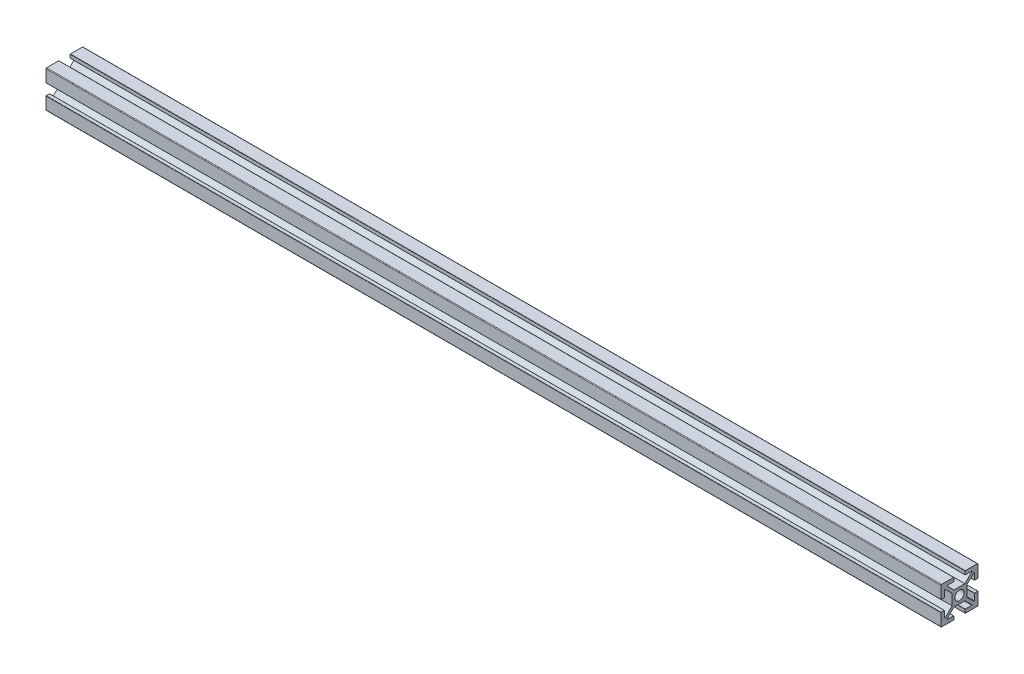
from build123d import *

# Parameters (mm, degrees)
SKETCH1_R           = 2.5
BOSS_EXTRUDE1_DEPTH = 485
SKETCH2_R           = 2.5
CUT_EXTRUDE1_DEPTH  = 2


with BuildPart() as part:
    # Sketch1 → Boss-Extrude1 (new body)
    with BuildSketch(Plane(origin=(0, 0, 0), x_dir=(0, 0, -1), z_dir=(1, 0, 0))):
        with BuildLine():
            Line((-7.427382464, 2.155691805), (-5.727382464, 2.155691805))
            ThreePointArc((-5.727382464, 2.155691805), (-5.621316447, 2.199625788), (-5.577382464, 2.305691805))
            Line((-5.577382464, 2.305691805), (-5.577382464, 5.741876319))
            ThreePointArc((-5.577382464, 5.741876319), (-5.485183419, 5.880292537), (-5.321928469, 5.848550846))
            Line((-5.321928469, 5.848550846), (-1.531086168, 2.101082027))
            Line((-1.531086168, 2.101082027), (-1.531086168, -3.789698417))
            Line((-1.531086168, -3.789698417), (-5.321928469, -7.537167236))
            ThreePointArc((-5.321928469, -7.537167236), (-5.485183419, -7.568908927), (-5.577382464, -7.430492708))
            Line((-5.577382464, -7.430492708), (-5.577382464, -3.994308195))
            ThreePointArc((-5.577382464, -3.994308195), (-5.621316447, -3.888242178), (-5.727382464, -3.844308195))
            Line((-5.727382464, -3.844308195), (-7.427382464, -3.844308195))
            ThreePointArc((-7.427382464, -3.844308195), (-7.533448481, -3.888242178), (-7.577382464, -3.994308195))
            Line((-7.577382464, -3.994308195), (-7.577382464, -10.494308195))
            ThreePointArc((-7.577382464, -10.494308195), (-7.474869837, -10.741795568), (-7.227382464, -10.844308195))
            Line((-7.227382464, -10.844308195), (-0.727382464, -10.844308195))
            ThreePointArc((-0.727382464, -10.844308195), (-0.621316447, -10.800374212), (-0.577382464, -10.694308195))
            Line((-0.577382464, -10.694308195), (-0.577382464, -8.994308195))
            ThreePointArc((-0.577382464, -8.994308195), (-0.621316447, -8.888242178), (-0.727382464, -8.844308195))
            Line((-0.727382464, -8.844308195), (-4.145467261, -8.844308195))
            ThreePointArc((-4.145467261, -8.844308195), (-4.284213755, -8.751311795), (-4.250921257, -8.587633667))
            Line((-4.250921257, -8.587633667), (-0.464270258, -4.844308195))
            Line((-0.464270258, -4.844308195), (5.402097922, -4.844308195))
            Line((5.402097922, -4.844308195), (9.188748921, -8.587633667))
            ThreePointArc((9.188748921, -8.587633667), (9.22204142, -8.751311795), (9.083294926, -8.844308195))
            Line((9.083294926, -8.844308195), (5.665210129, -8.844308195))
            ThreePointArc((5.665210129, -8.844308195), (5.559144111, -8.888242178), (5.515210129, -8.994308195))
            Line((5.515210129, -8.994308195), (5.515210129, -10.694308195))
            ThreePointArc((5.515210129, -10.694308195), (5.559144111, -10.800374212), (5.665210129, -10.844308195))
            Line((5.665210129, -10.844308195), (12.165210129, -10.844308195))
            ThreePointArc((12.165210129, -10.844308195), (12.412697502, -10.741795568), (12.515210129, -10.494308195))
            Line((12.515210129, -10.494308195), (12.515210129, -3.994308195))
            ThreePointArc((12.515210129, -3.994308195), (12.471276146, -3.888242178), (12.365210129, -3.844308195))
            Line((12.365210129, -3.844308195), (10.665210129, -3.844308195))
            ThreePointArc((10.665210129, -3.844308195), (10.559144111, -3.888242178), (10.515210129, -3.994308195))
            Line((10.515210129, -3.994308195), (10.515210129, -7.430492708))
            ThreePointArc((10.515210129, -7.430492708), (10.423011083, -7.568908927), (10.259756133, -7.537167236))
            Line((10.259756133, -7.537167236), (6.468913832, -3.789698417))
            Line((6.468913832, -3.789698417), (6.468913832, 2.101082027))
            Line((6.468913832, 2.101082027), (10.259756133, 5.848550846))
            ThreePointArc((10.259756133, 5.848550846), (10.423011083, 5.880292537), (10.515210129, 5.741876319))
            Line((10.515210129, 5.741876319), (10.515210129, 2.305691805))
            ThreePointArc((10.515210129, 2.305691805), (10.559144111, 2.199625788), (10.665210129, 2.155691805))
            Line((10.665210129, 2.155691805), (12.365210129, 2.155691805))
            ThreePointArc((12.365210129, 2.155691805), (12.471276146, 2.199625788), (12.515210129, 2.305691805))
            Line((12.515210129, 2.305691805), (12.515210129, 8.805691805))
            ThreePointArc((12.515210129, 8.805691805), (12.412697502, 9.053179179), (12.165210129, 9.155691805))
            Line((12.165210129, 9.155691805), (5.665210129, 9.155691805))
            ThreePointArc((5.665210129, 9.155691805), (5.559144111, 9.111757822), (5.515210129, 9.005691805))
            Line((5.515210129, 9.005691805), (5.515210129, 7.305691805))
            ThreePointArc((5.515210129, 7.305691805), (5.559144111, 7.199625788), (5.665210129, 7.155691805))
            Line((5.665210129, 7.155691805), (9.083294926, 7.155691805))
            ThreePointArc((9.083294926, 7.155691805), (9.22204142, 7.062695405), (9.188748921, 6.899017277))
            Line((9.188748921, 6.899017277), (5.402097922, 3.155691805))
            Line((5.402097922, 3.155691805), (-0.464270258, 3.155691805))
            Line((-0.464270258, 3.155691805), (-4.250921257, 6.899017277))
            ThreePointArc((-4.250921257, 6.899017277), (-4.284213755, 7.062695405), (-4.145467261, 7.155691805))
            Line((-4.145467261, 7.155691805), (-0.727382464, 7.155691805))
            ThreePointArc((-0.727382464, 7.155691805), (-0.621316447, 7.199625788), (-0.577382464, 7.305691805))
            Line((-0.577382464, 7.305691805), (-0.577382464, 9.005691805))
            ThreePointArc((-0.577382464, 9.005691805), (-0.621316447, 9.111757822), (-0.727382464, 9.155691805))
            Line((-0.727382464, 9.155691805), (-7.227382464, 9.155691805))
            ThreePointArc((-7.227382464, 9.155691805), (-7.474869837, 9.053179179), (-7.577382464, 8.805691805))
            Line((-7.577382464, 8.805691805), (-7.577382464, 2.305691805))
            ThreePointArc((-7.577382464, 2.305691805), (-7.533448481, 2.199625788), (-7.427382464, 2.155691805))
        make_face()
        with Locations((2.468913832, -0.844308195)):
            Circle(SKETCH1_R, mode=Mode.SUBTRACT)
    extrude(amount=BOSS_EXTRUDE1_DEPTH)

    # Sketch2 → Cut-Extrude1 (cut)
    with BuildSketch(Plane(origin=(0, 3.155691805, 0), x_dir=(1, 0, 0), z_dir=(0, 1, 0))):
        with Locations(Location((20, 2.468913832, 0), (0, 0, 270))):
            Circle(SKETCH2_R)
        with Locations(Location((185, 2.468913832, 0), (0, 0, 270))):
            Circle(SKETCH2_R)
        with Locations(Location((465, 2.468913832, 0), (0, 0, 270))):
            Circle(SKETCH2_R)
        with Locations(Location((62, 2.468913832, 0), (0, 0, 270))):
            Circle(SKETCH2_R)
        with Locations(Location((423, 2.468913832, 0), (0, 0, 270))):
            Circle(SKETCH2_R)
        with Locations(Location((335, 2.468913832, 0), (0, 0, 270))):
            Circle(SKETCH2_R)
        with Locations(Location((385, 2.468913832, 0), (0, 0, 270))):
            Circle(SKETCH2_R)
        with Locations(Location((100, 2.468913832, 0), (0, 0, 270))):
            Circle(SKETCH2_R)
    extrude(amount=-CUT_EXTRUDE1_DEPTH, mode=Mode.SUBTRACT)


solid = part.part
